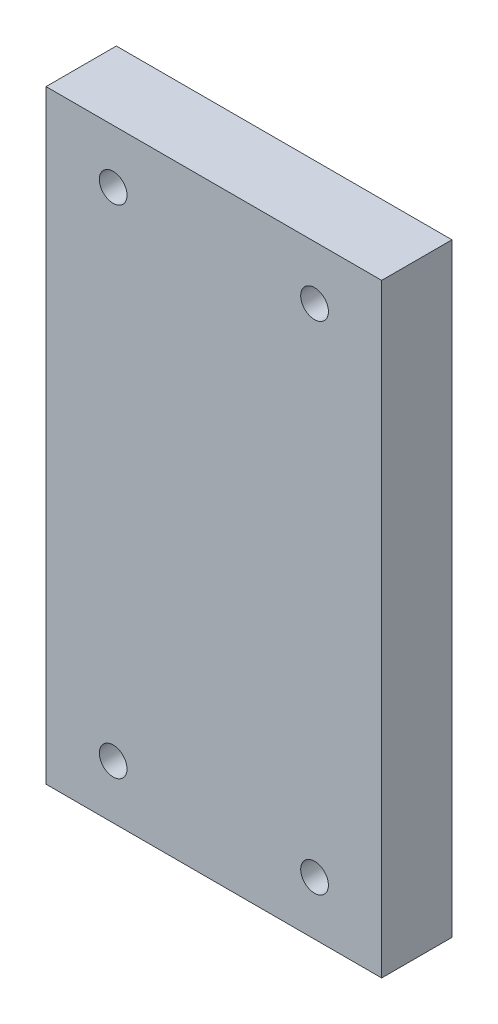
from build123d import *

# Parameters (mm, degrees)
SKETCH1_W           = 50
SKETCH1_H           = 90
SKETCH1_R           = 2.065
BOSS_EXTRUDE1_DEPTH = 10.47


with BuildPart() as part:
    # Sketch1 → Boss-Extrude1 (new body)
    with BuildSketch(Plane.XY):
        with Locations((25, 45)):
            Rectangle(SKETCH1_W, SKETCH1_H)
        with Locations((40, 8)):
            Circle(SKETCH1_R, mode=Mode.SUBTRACT)
        with Locations((10, 8)):
            Circle(SKETCH1_R, mode=Mode.SUBTRACT)
        with Locations((40, 82)):
            Circle(SKETCH1_R, mode=Mode.SUBTRACT)
        with Locations((10, 82)):
            Circle(SKETCH1_R, mode=Mode.SUBTRACT)
    extrude(amount=BOSS_EXTRUDE1_DEPTH)


solid = part.part
